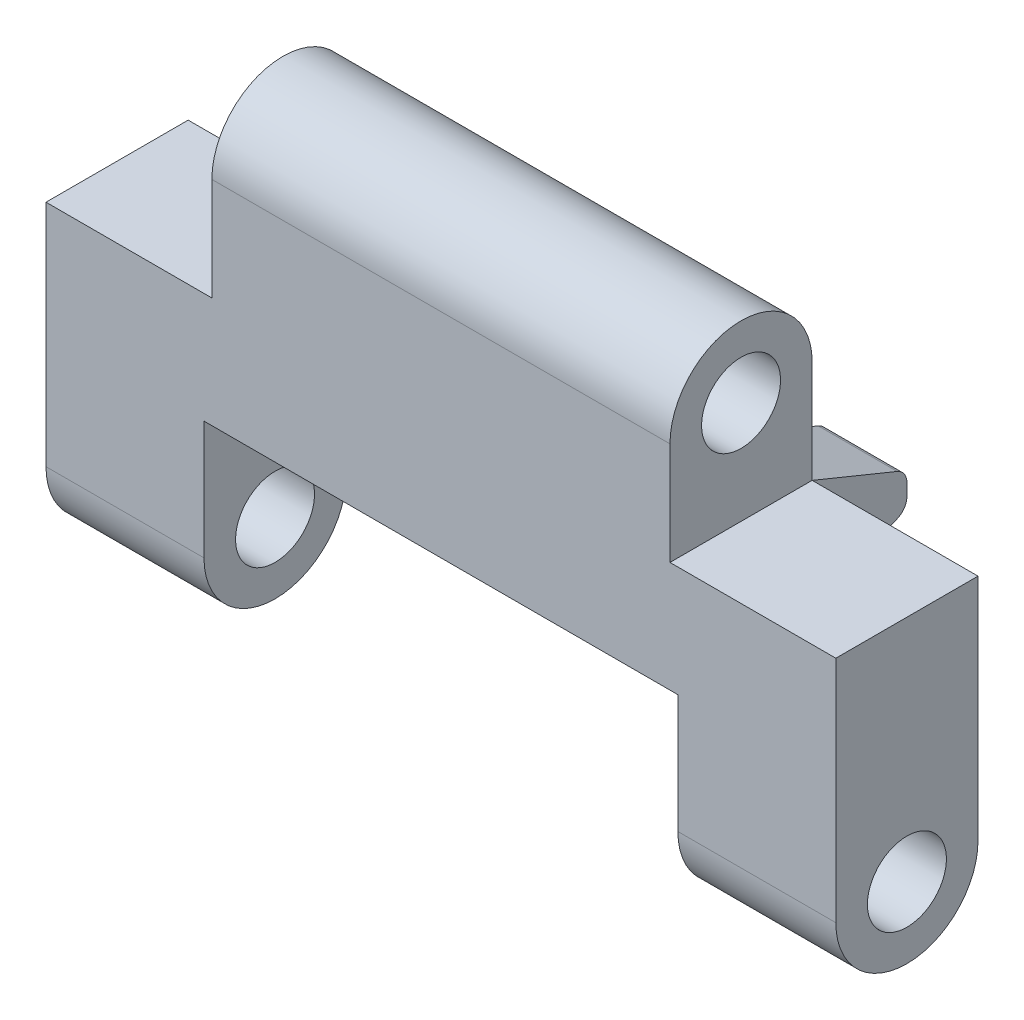
from build123d import *

# Parameters (mm, degrees)
BOSS_EXTRUDE1_DEPTH = 9
SKETCH2_R           = 2.5
CUT_EXTRUDE1_DEPTH  = 56
SKETCH5_W           = 5
SKETCH5_H           = 7
BOSS_EXTRUDE2_DEPTH = 6
CUT_EXTRUDE3_DEPTH  = 30
CUT_EXTRUDE4_DEPTH  = 60


with BuildPart() as part:
    # Sketch1 → Boss-Extrude1 (new body)
    with BuildSketch(Plane.XY):
        Polygon((0, 0), (10.5, 0), (10.5, 11), (39.5, 11), (39.5, 0), (50, 0), (50, -19), (40, -19), (40, -7), (10, -7), (10, -19), (0, -19), align=None)
    extrude(amount=BOSS_EXTRUDE1_DEPTH)

    # Sketch2 → Cut-Extrude1 (cut)
    with BuildSketch(Plane.ZY):
        with Locations((4.5, -14.5)):
            Circle(SKETCH2_R)
        with Locations((4.5, 6.5)):
            Circle(SKETCH2_R)
    extrude(amount=-CUT_EXTRUDE1_DEPTH, mode=Mode.SUBTRACT)

    # Sketch5 → Boss-Extrude2 (add)
    with BuildSketch(Plane(origin=(0, 0, 0), x_dir=(-1, 0, 0), z_dir=(0, 0, -1))):
        with Locations((-13.001, -3.5)):
            Rectangle(SKETCH5_W, SKETCH5_H)
        with Locations((-37.001, -3.5)):
            Rectangle(SKETCH5_W, SKETCH5_H)
    extrude(amount=BOSS_EXTRUDE2_DEPTH)

    # Sketch6 → Cut-Extrude3 (cut)
    with BuildSketch(Plane(origin=(39.501, 0, 0), x_dir=(0, 0, -1), z_dir=(1, 0, 0))):
        with BuildLine():
            Line((0, -7), (5.378584213, -4.8))
            ThreePointArc((5.378584213, -4.8), (5.830236175, -4.431844931), (6, -3.87443315))
            Line((6, -3.87443315), (6, -3.12556685))
            ThreePointArc((6, -3.12556685), (5.830236175, -2.568155069), (5.378584213, -2.2))
            Line((5.378584213, -2.2), (0, 0))
            Line((0, 0), (0, 0.711055657))
            Line((0, 0.711055657), (7.382706711, 0.711055657))
            Line((7.382706711, 0.711055657), (7.382706711, -8.433389186))
            Line((7.382706711, -8.433389186), (0, -8.433389186))
            Line((0, -8.433389186), (0, -7))
        make_face()
    extrude(amount=-CUT_EXTRUDE3_DEPTH, mode=Mode.SUBTRACT)

    # Sketch7 → Cut-Extrude4 (cut)
    with BuildSketch(Plane(origin=(50, 0, 0), x_dir=(0, 0, -1), z_dir=(1, 0, 0))):
        with BuildLine():
            Line((0, 6.5), (1.728310858, 6.5))
            Line((1.728310858, 6.5), (1.728310858, 12.31373859))
            Line((1.728310858, 12.31373859), (-10.493151676, 12.31373859))
            Line((-10.493151676, 12.31373859), (-10.493151676, 4.742580982))
            Line((-10.493151676, 4.742580982), (-9, 6.5))
            ThreePointArc((-9, 6.5), (-4.5, 11), (0, 6.5))
        make_face()
        with BuildLine():
            Line((0, -14.5), (1.22869132, -14.5))
            Line((1.22869132, -14.5), (1.22869132, -21.122338154))
            Line((1.22869132, -21.122338154), (-10.493151676, -21.122338154))
            Line((-10.493151676, -21.122338154), (-10.493151676, -14.5))
            Line((-10.493151676, -14.5), (-9, -14.5))
            ThreePointArc((-9, -14.5), (-4.5, -19), (0, -14.5))
        make_face()
    extrude(amount=-CUT_EXTRUDE4_DEPTH, mode=Mode.SUBTRACT)


solid = part.part
